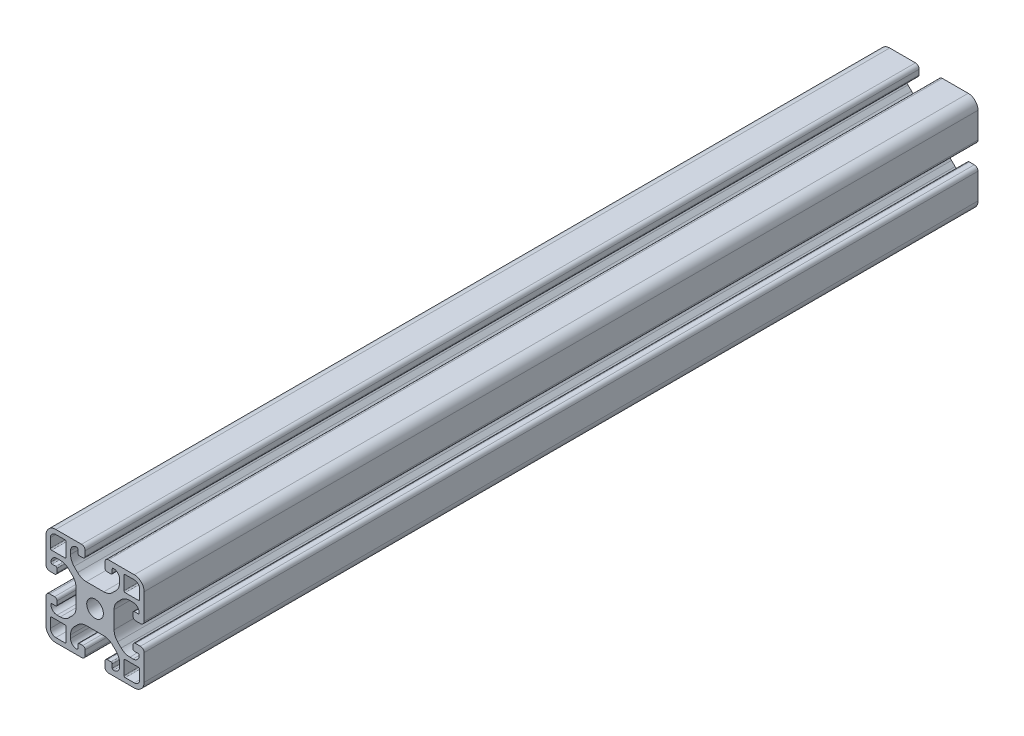
from build123d import *

# Parameters (mm, degrees)
ESQUISSE1_R        = 3.4
BOSS_EXTRU_1_DEPTH = 340


with BuildPart() as part:
    # Esquisse1 → Boss.-Extru.1 (new body)
    with BuildSketch(Plane(origin=(0, 0, -30), x_dir=(-1, 0, 0), z_dir=(0, 0, -1))):
        with BuildLine():
            Line((-4.5, 15), (-4.5, 13.5))
            ThreePointArc((-4.5, 13.5), (-4.353553391, 13.146446609), (-4, 13))
            Line((-4, 13), (-2.5, 13))
            ThreePointArc((-2.5, 13), (-2.146446609, 12.853553391), (-2, 12.5))
            ThreePointArc((-2, 12.5), (-2.732233047, 10.732233047), (-4.5, 10))
            Line((-4.5, 10), (-5.807611845, 10))
            ThreePointArc((-5.807611845, 10), (-7.721029006, 10.380602337), (-9.343145751, 11.464466094))
            Line((-9.343145751, 11.464466094), (-10.785533906, 12.906854249))
            ThreePointArc((-10.785533906, 12.906854249), (-11.869397663, 14.528970994), (-12.25, 16.442388155))
            Line((-12.25, 16.442388155), (-12.25, 23.557611845))
            ThreePointArc((-12.25, 23.557611845), (-11.869397663, 25.471029006), (-10.785533906, 27.093145751))
            Line((-10.785533906, 27.093145751), (-9.343145751, 28.535533906))
            ThreePointArc((-9.343145751, 28.535533906), (-7.721029006, 29.619397663), (-5.807611845, 30))
            Line((-5.807611845, 30), (-4.5, 30))
            ThreePointArc((-4.5, 30), (-2.732233047, 29.267766953), (-2, 27.5))
            ThreePointArc((-2, 27.5), (-2.146446609, 27.146446609), (-2.5, 27))
            Line((-2.5, 27), (-4, 27))
            ThreePointArc((-4, 27), (-4.353553391, 26.853553391), (-4.5, 26.5))
            Line((-4.5, 26.5), (-4.5, 25))
            ThreePointArc((-4.5, 25), (-4.207106781, 24.292893219), (-3.5, 24))
            Line((-3.5, 24), (-1.5, 24))
            ThreePointArc((-1.5, 24), (-0.439339828, 24.439339828), (0, 25.5))
            Line((0, 25.5), (0, 36))
            ThreePointArc((0, 36), (-1.171572875, 38.828427125), (-4, 40))
            Line((-4, 40), (-14.5, 40))
            ThreePointArc((-14.5, 40), (-15.560660172, 39.560660172), (-16, 38.5))
            Line((-16, 38.5), (-16, 36.5))
            ThreePointArc((-16, 36.5), (-15.707106781, 35.792893219), (-15, 35.5))
            Line((-15, 35.5), (-13.5, 35.5))
            ThreePointArc((-13.5, 35.5), (-13.146446609, 35.646446609), (-13, 36))
            Line((-13, 36), (-13, 37.5))
            ThreePointArc((-13, 37.5), (-12.853553391, 37.853553391), (-12.5, 38))
            ThreePointArc((-12.5, 38), (-10.732233047, 37.267766953), (-10, 35.5))
            Line((-10, 35.5), (-10, 34.192388155))
            ThreePointArc((-10, 34.192388155), (-10.380602337, 32.278970994), (-11.464466094, 30.656854249))
            Line((-11.464466094, 30.656854249), (-12.906854249, 29.214466094))
            ThreePointArc((-12.906854249, 29.214466094), (-14.528970994, 28.130602337), (-16.442388155, 27.75))
            Line((-16.442388155, 27.75), (-23.557611845, 27.75))
            ThreePointArc((-23.557611845, 27.75), (-25.471029006, 28.130602337), (-27.093145751, 29.214466094))
            Line((-27.093145751, 29.214466094), (-28.535533906, 30.656854249))
            ThreePointArc((-28.535533906, 30.656854249), (-29.619397663, 32.278970994), (-30, 34.192388155))
            Line((-30, 34.192388155), (-30, 35.5))
            ThreePointArc((-30, 35.5), (-29.267766953, 37.267766953), (-27.5, 38))
            ThreePointArc((-27.5, 38), (-27.146446609, 37.853553391), (-27, 37.5))
            Line((-27, 37.5), (-27, 36))
            ThreePointArc((-27, 36), (-26.853553391, 35.646446609), (-26.5, 35.5))
            Line((-26.5, 35.5), (-25, 35.5))
            ThreePointArc((-25, 35.5), (-24.292893219, 35.792893219), (-24, 36.5))
            Line((-24, 36.5), (-24, 38.5))
            ThreePointArc((-24, 38.5), (-24.439339828, 39.560660172), (-25.5, 40))
            Line((-25.5, 40), (-36, 40))
            ThreePointArc((-36, 40), (-38.828427125, 38.828427125), (-40, 36))
            Line((-40, 36), (-40, 25.5))
            ThreePointArc((-40, 25.5), (-39.560660172, 24.439339828), (-38.5, 24))
            Line((-38.5, 24), (-36.5, 24))
            ThreePointArc((-36.5, 24), (-35.792893219, 24.292893219), (-35.5, 25))
            Line((-35.5, 25), (-35.5, 26.5))
            ThreePointArc((-35.5, 26.5), (-35.646446609, 26.853553391), (-36, 27))
            Line((-36, 27), (-37.5, 27))
            ThreePointArc((-37.5, 27), (-37.853553391, 27.146446609), (-38, 27.5))
            ThreePointArc((-38, 27.5), (-37.267766953, 29.267766953), (-35.5, 30))
            Line((-35.5, 30), (-34.192388155, 30))
            ThreePointArc((-34.192388155, 30), (-32.278970994, 29.619397663), (-30.656854249, 28.535533906))
            Line((-30.656854249, 28.535533906), (-29.214466094, 27.093145751))
            ThreePointArc((-29.214466094, 27.093145751), (-28.130602337, 25.471029006), (-27.75, 23.557611845))
            Line((-27.75, 23.557611845), (-27.75, 16.442388155))
            ThreePointArc((-27.75, 16.442388155), (-28.130602337, 14.528970994), (-29.214466094, 12.906854249))
            Line((-29.214466094, 12.906854249), (-30.656854249, 11.464466094))
            ThreePointArc((-30.656854249, 11.464466094), (-32.278970994, 10.380602337), (-34.192388155, 10))
            Line((-34.192388155, 10), (-35.5, 10))
            ThreePointArc((-35.5, 10), (-37.267766953, 10.732233047), (-38, 12.5))
            ThreePointArc((-38, 12.5), (-37.853553391, 12.853553391), (-37.5, 13))
            Line((-37.5, 13), (-36, 13))
            ThreePointArc((-36, 13), (-35.646446609, 13.146446609), (-35.5, 13.5))
            Line((-35.5, 13.5), (-35.5, 15))
            ThreePointArc((-35.5, 15), (-35.792893219, 15.707106781), (-36.5, 16))
            Line((-36.5, 16), (-38.5, 16))
            ThreePointArc((-38.5, 16), (-39.560660172, 15.560660172), (-40, 14.5))
            Line((-40, 14.5), (-40, 4))
            ThreePointArc((-40, 4), (-38.828427125, 1.171572875), (-36, 0))
            Line((-36, 0), (-25.5, 0))
            ThreePointArc((-25.5, 0), (-24.439339828, 0.439339828), (-24, 1.5))
            Line((-24, 1.5), (-24, 3.5))
            ThreePointArc((-24, 3.5), (-24.292893219, 4.207106781), (-25, 4.5))
            Line((-25, 4.5), (-26.5, 4.5))
            ThreePointArc((-26.5, 4.5), (-26.853553391, 4.353553391), (-27, 4))
            Line((-27, 4), (-27, 2.5))
            ThreePointArc((-27, 2.5), (-27.146446609, 2.146446609), (-27.5, 2))
            ThreePointArc((-27.5, 2), (-29.267766953, 2.732233047), (-30, 4.5))
            Line((-30, 4.5), (-30, 5.807611845))
            ThreePointArc((-30, 5.807611845), (-29.619397663, 7.721029006), (-28.535533906, 9.343145751))
            Line((-28.535533906, 9.343145751), (-27.093145751, 10.785533906))
            ThreePointArc((-27.093145751, 10.785533906), (-25.471029006, 11.869397663), (-23.557611845, 12.25))
            Line((-23.557611845, 12.25), (-16.442388155, 12.25))
            ThreePointArc((-16.442388155, 12.25), (-14.528970994, 11.869397663), (-12.906854249, 10.785533906))
            Line((-12.906854249, 10.785533906), (-11.464466094, 9.343145751))
            ThreePointArc((-11.464466094, 9.343145751), (-10.380602337, 7.721029006), (-10, 5.807611845))
            Line((-10, 5.807611845), (-10, 4.5))
            ThreePointArc((-10, 4.5), (-10.732233047, 2.732233047), (-12.5, 2))
            ThreePointArc((-12.5, 2), (-12.853553391, 2.146446609), (-13, 2.5))
            Line((-13, 2.5), (-13, 4))
            ThreePointArc((-13, 4), (-13.146446609, 4.353553391), (-13.5, 4.5))
            Line((-13.5, 4.5), (-15, 4.5))
            ThreePointArc((-15, 4.5), (-15.707106781, 4.207106781), (-16, 3.5))
            Line((-16, 3.5), (-16, 1.5))
            ThreePointArc((-16, 1.5), (-15.560660172, 0.439339828), (-14.5, 0))
            Line((-14.5, 0), (-4, 0))
            ThreePointArc((-4, 0), (-1.171572875, 1.171572875), (0, 4))
            Line((0, 4), (0, 14.5))
            ThreePointArc((0, 14.5), (-0.439339828, 15.560660172), (-1.5, 16))
            Line((-1.5, 16), (-3.5, 16))
            ThreePointArc((-3.5, 16), (-4.207106781, 15.707106781), (-4.5, 15))
        make_face()
        with Locations(Location((-20, 20, 0), (0, 0, 180))):
            Circle(ESQUISSE1_R, mode=Mode.SUBTRACT)
        with BuildLine():
            Line((-4, 1.8), (-7.7, 1.8))
            ThreePointArc((-7.7, 1.8), (-8.053553391, 1.946446609), (-8.2, 2.3))
            Line((-8.2, 2.3), (-8.2, 7.7))
            ThreePointArc((-8.2, 7.7), (-8.053553391, 8.053553391), (-7.7, 8.2))
            Line((-7.7, 8.2), (-2.3, 8.2))
            ThreePointArc((-2.3, 8.2), (-1.946446609, 8.053553391), (-1.8, 7.7))
            Line((-1.8, 7.7), (-1.8, 4))
            ThreePointArc((-1.8, 4), (-2.444365081, 2.444365081), (-4, 1.8))
        make_face(mode=Mode.SUBTRACT)
        with BuildLine():
            Line((-38.2, 4), (-38.2, 7.7))
            ThreePointArc((-38.2, 7.7), (-38.053553391, 8.053553391), (-37.7, 8.2))
            Line((-37.7, 8.2), (-32.3, 8.2))
            ThreePointArc((-32.3, 8.2), (-31.946446609, 8.053553391), (-31.8, 7.7))
            Line((-31.8, 7.7), (-31.8, 2.3))
            ThreePointArc((-31.8, 2.3), (-31.946446609, 1.946446609), (-32.3, 1.8))
            Line((-32.3, 1.8), (-36, 1.8))
            ThreePointArc((-36, 1.8), (-37.555634919, 2.444365081), (-38.2, 4))
        make_face(mode=Mode.SUBTRACT)
        with BuildLine():
            Line((-36, 38.2), (-32.3, 38.2))
            ThreePointArc((-32.3, 38.2), (-31.946446609, 38.053553391), (-31.8, 37.7))
            Line((-31.8, 37.7), (-31.8, 32.3))
            ThreePointArc((-31.8, 32.3), (-31.946446609, 31.946446609), (-32.3, 31.8))
            Line((-32.3, 31.8), (-37.7, 31.8))
            ThreePointArc((-37.7, 31.8), (-38.053553391, 31.946446609), (-38.2, 32.3))
            Line((-38.2, 32.3), (-38.2, 36))
            ThreePointArc((-38.2, 36), (-37.555634919, 37.555634919), (-36, 38.2))
        make_face(mode=Mode.SUBTRACT)
        with BuildLine():
            Line((-1.8, 36), (-1.8, 32.3))
            ThreePointArc((-1.8, 32.3), (-1.946446609, 31.946446609), (-2.3, 31.8))
            Line((-2.3, 31.8), (-7.7, 31.8))
            ThreePointArc((-7.7, 31.8), (-8.053553391, 31.946446609), (-8.2, 32.3))
            Line((-8.2, 32.3), (-8.2, 37.7))
            ThreePointArc((-8.2, 37.7), (-8.053553391, 38.053553391), (-7.7, 38.2))
            Line((-7.7, 38.2), (-4, 38.2))
            ThreePointArc((-4, 38.2), (-2.444365081, 37.555634919), (-1.8, 36))
        make_face(mode=Mode.SUBTRACT)
    extrude(amount=-BOSS_EXTRU_1_DEPTH)


solid = part.part
